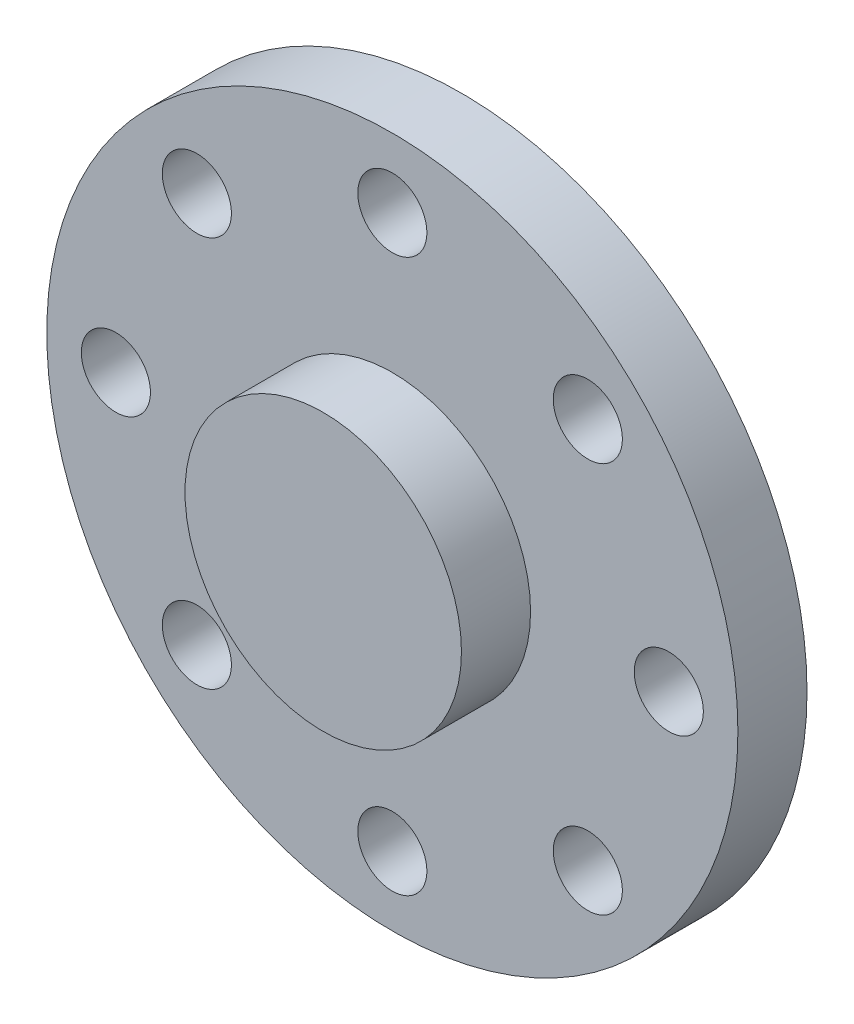
from build123d import *

# Parameters (mm, degrees)
ESQUISSE2_R        = 10
ESQUISSE2_R_2      = 1
BOSS_EXTRU_1_DEPTH = 2
BOSS_EXTRU_2_DEPTH = 2


with BuildPart() as part:
    # Esquisse2 → Boss.-Extru.1 (new body)
    with BuildSketch(Plane.XY):
        with Locations((22.149661623, 17.880169066)):
            Circle(ESQUISSE2_R)
        with Locations((16.492807374, 23.537023315)):
            Circle(ESQUISSE2_R_2, mode=Mode.SUBTRACT)
        with Locations((22.149661623, 25.880169066)):
            Circle(ESQUISSE2_R_2, mode=Mode.SUBTRACT)
        with Locations((27.806515873, 23.537023315)):
            Circle(ESQUISSE2_R_2, mode=Mode.SUBTRACT)
        with Locations((30.149661623, 17.880169066)):
            Circle(ESQUISSE2_R_2, mode=Mode.SUBTRACT)
        with Locations((27.806515873, 12.223314816)):
            Circle(ESQUISSE2_R_2, mode=Mode.SUBTRACT)
        with Locations((22.149661623, 9.880169066)):
            Circle(ESQUISSE2_R_2, mode=Mode.SUBTRACT)
        with Locations((16.492807374, 12.223314816)):
            Circle(ESQUISSE2_R_2, mode=Mode.SUBTRACT)
        with Locations((14.149661623, 17.880169066)):
            Circle(ESQUISSE2_R_2, mode=Mode.SUBTRACT)
    extrude(amount=BOSS_EXTRU_1_DEPTH)

    # Esquisse3 → Boss.-Extru.2 (add)
    with BuildSketch(Plane.XY.offset(2)):
        with BuildLine():
            ThreePointArc((26.149661623, 17.880169066), (24.978088748, 20.70859619), (22.149661623, 21.880169066))
            Line((22.149661623, 21.880169066), (22.149661623, 13.880169066))
            ThreePointArc((22.149661623, 13.880169066), (24.978088748, 15.051741941), (26.149661623, 17.880169066))
        make_face()
        with BuildLine():
            Line((22.149661623, 13.880169066), (22.149661623, 21.880169066))
            ThreePointArc((22.149661623, 21.880169066), (18.149661623, 17.880169066), (22.149661623, 13.880169066))
        make_face()
    extrude(amount=BOSS_EXTRU_2_DEPTH)


solid = part.part
